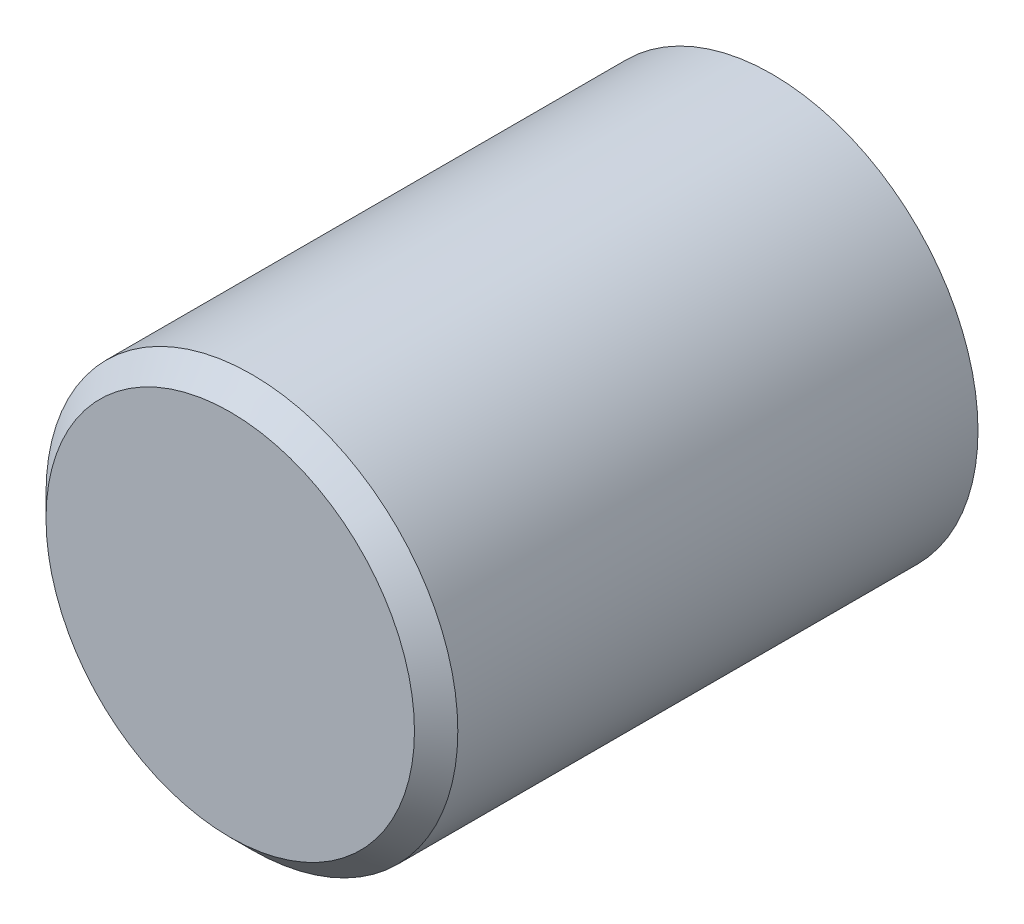
from build123d import *

# Parameters (mm, degrees)
CROQUIS1_R              = 19
SALIENTE_EXTRUIR1_DEPTH = 50
CHAFL_N1_SIZE           = 2
CROQUIS2_R              = 8
CORTAR_EXTRUIR1_DEPTH   = 30


with BuildPart() as part:
    # Croquis1 → Saliente-Extruir1 (new body)
    with BuildSketch(Plane.XY):
        Circle(CROQUIS1_R)
    extrude(amount=-SALIENTE_EXTRUIR1_DEPTH)

    # Chaflán1
    chafl_n1_edges = [part.edges().sort_by_distance(p)[0] for p in [
        (-19, 0, 0),
    ]]
    chamfer(chafl_n1_edges, length=CHAFL_N1_SIZE)

    # Croquis2 → Cortar-Extruir1 (cut)
    with BuildSketch(Plane(origin=(0, 0, -50), x_dir=(-1, 0, 0), z_dir=(0, 0, -1))):
        Circle(CROQUIS2_R)
    extrude(amount=-CORTAR_EXTRUIR1_DEPTH, mode=Mode.SUBTRACT)


solid = part.part
